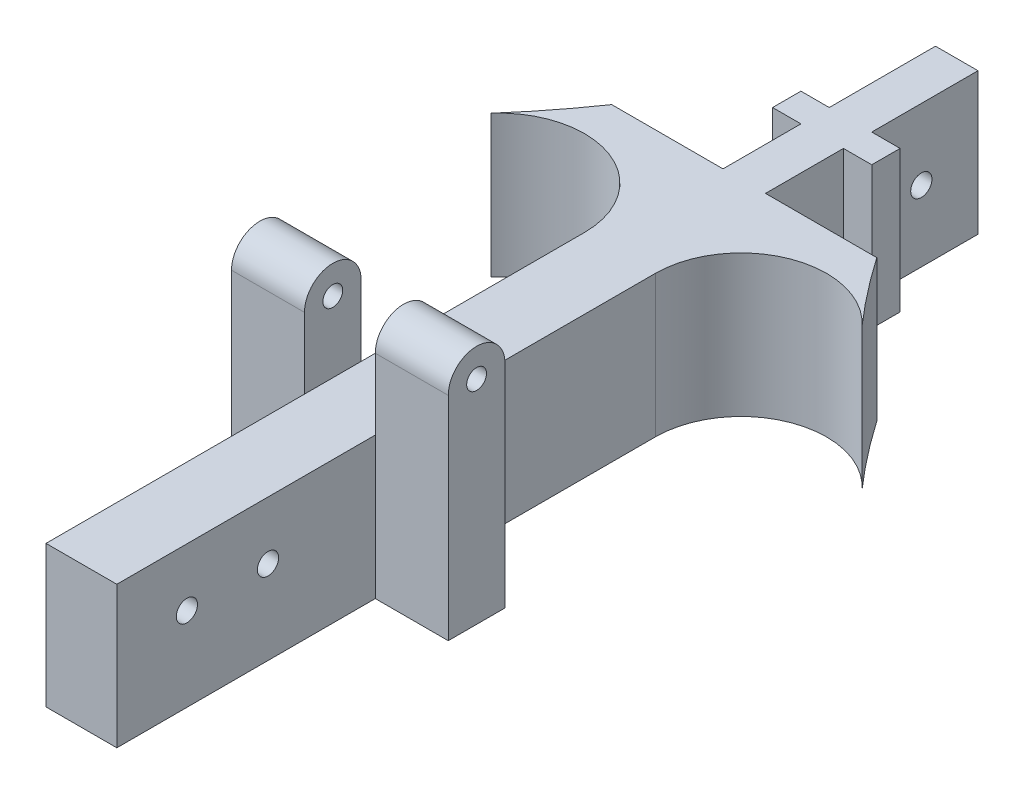
from build123d import *

# Parameters (mm, degrees)
BOSS_EXTRU_1_DEPTH      = 20
ESQUISSE3_R             = 1.5
ENL_V_MAT_EXTRU_3_DEPTH = 20
ESQUISSE4_R             = 1.5
ENL_V_MAT_EXTRU_4_DEPTH = 10
ESQUISSE5_R             = 1.5
ENL_V_MAT_EXTRU_5_DEPTH = 10
ESQUISSE6_R             = 1.4
BOSS_EXTRU_2_DEPTH      = 10.3


with BuildPart() as part:
    # Esquisse1 → Boss.-Extru.1 (new body)
    with BuildSketch(Plane(origin=(0, 0, 0), x_dir=(1, 0, 0), z_dir=(0, 1, 0))):
        with BuildLine():
            Line((-3, 84.398281038), (-3, 69.398281038))
            Line((-3, 69.398281038), (-7, 69.398281038))
            Line((-7, 69.398281038), (-7, 65.398281038))
            Line((-7, 65.398281038), (-3, 65.398281038))
            Line((-3, 65.398281038), (-3, 54.398281038))
            Line((-3, 54.398281038), (-18.71, 54.398281038))
            ThreePointArc((-18.71, 54.398281038), (-22.308577777, 49.499317693), (-26.183329952, 44.81574006))
            ThreePointArc((-26.183329952, 44.81574006), (-12.83252844, 48.159570073), (-5, 36.842476876))
            Line((-5, 36.842476876), (-5, -39.182739587))
            Line((-5, -39.182739587), (0, -39.182739587))
            Line((0, -39.182739587), (0, 84.398281038))
            Line((0, 84.398281038), (-3, 84.398281038))
        make_face()
    boss_extru_1 = extrude(amount=BOSS_EXTRU_1_DEPTH)

    # Symétrie1: Boss.-Extru.1 across plane
    add(boss_extru_1.mirror(Plane(origin=(0, 20, -84.398281038), x_dir=(0, 0, 1), z_dir=(-1, 0, 0))))

    # Esquisse3 → Enlèv. mat.-Extru.3 (cut)
    with BuildSketch(Plane.ZY.offset(3)):
        with Locations((-76.398281038, 10)):
            Circle(ESQUISSE3_R)
        with Locations((-60.398281038, 10)):
            Circle(ESQUISSE3_R)
    extrude(amount=-ENL_V_MAT_EXTRU_3_DEPTH, mode=Mode.SUBTRACT)

    # Esquisse4 → Enlèv. mat.-Extru.4 (cut)
    with BuildSketch(Plane.ZY.offset(5)):
        with Locations((29.291975875, 11.84)):
            Circle(ESQUISSE4_R)
    extrude(amount=-ENL_V_MAT_EXTRU_4_DEPTH, mode=Mode.SUBTRACT)

    # Esquisse5 → Enlèv. mat.-Extru.5 (cut)
    with BuildSketch(Plane.ZY.offset(5)):
        with Locations((17.841975875, 11.84)):
            Circle(ESQUISSE5_R)
    extrude(amount=-ENL_V_MAT_EXTRU_5_DEPTH, mode=Mode.SUBTRACT)

    # Esquisse6 → Boss.-Extru.2 (add)
    with BuildSketch(Plane(origin=(5, 0, 0), x_dir=(0, 0, -1), z_dir=(1, 0, 0))):
        with BuildLine():
            Line((5.308208853, 0), (-2.691791147, 0))
            Line((-2.691791147, 0), (-2.691791147, 30))
            ThreePointArc((-2.691791147, 30), (1.308208853, 34), (5.308208853, 30))
            Line((5.308208853, 30), (5.308208853, 0))
        make_face()
        with Locations(Location((1.308208853, 30, 0), (0, 0, 180))):
            Circle(ESQUISSE6_R, mode=Mode.SUBTRACT)
    boss_extru_2 = extrude(amount=BOSS_EXTRU_2_DEPTH)

    # Symétrie2: Boss.-Extru.2 across plane
    add(boss_extru_2.mirror(Plane.ZY))


solid = part.part
